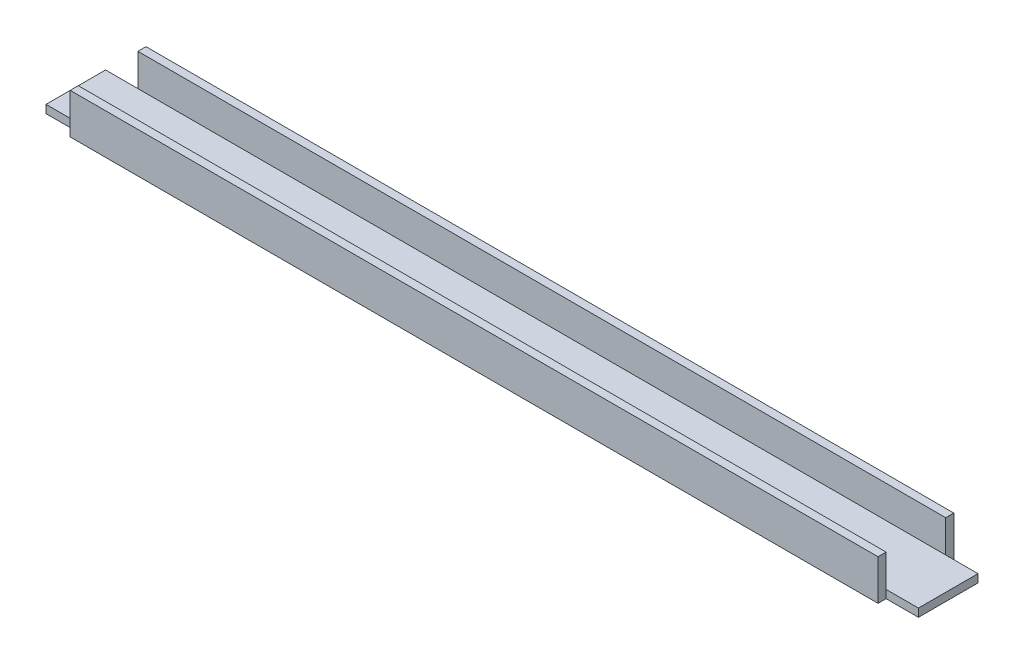
from build123d import *

# Parameters (mm, degrees)
C_CHANNEL_80_X_8_1_DEPTH = 800
SKETCH12_W               = 32
SKETCH12_H               = 59
BOSS_EXTRUDE1_DEPTH      = 8


with BuildPart() as part:
    # Sketch11 → C channel 80 X 8(1) (new body)
    with BuildSketch(Plane.YZ.offset(-400)):
        Polygon((0, -37.5), (0, 37.5), (40, 37.5), (40, 29.5), (8, 29.5), (8, -29.5), (40, -29.5), (40, -37.5), align=None)
    extrude(amount=C_CHANNEL_80_X_8_1_DEPTH)

    # Sketch12 → Boss-Extrude1 (add)
    with BuildSketch(Plane.XZ):
        with Locations((-416, 0)):
            Rectangle(SKETCH12_W, SKETCH12_H)
        with Locations((416, 0)):
            Rectangle(SKETCH12_W, SKETCH12_H)
    extrude(amount=-BOSS_EXTRUDE1_DEPTH)


solid = part.part
